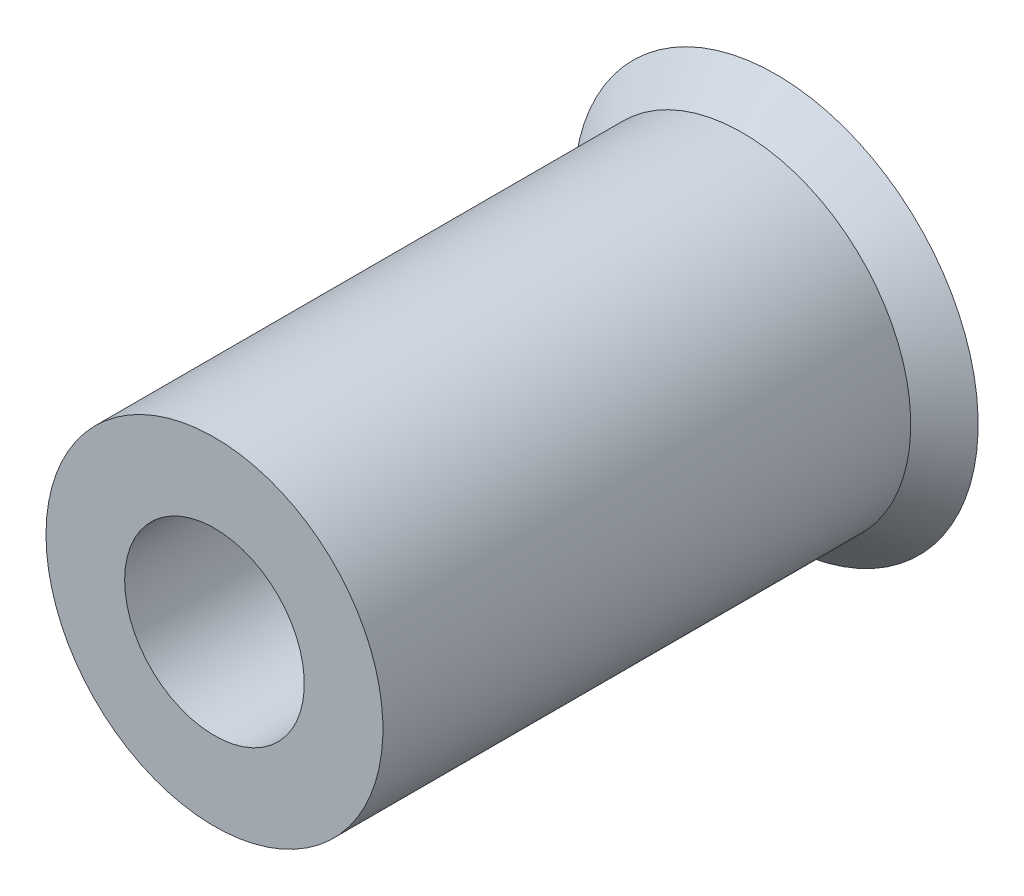
from build123d import *


with BuildPart() as part:
    # 草图1 → 旋转1 (revolve)
    with BuildSketch(Plane(origin=(0, 0, 0), x_dir=(0, 0, -1), z_dir=(1, 0, 0)), mode=Mode.PRIVATE) as revolve_1_sk:
        Polygon((-10, 1.6), (0, 1.6), (0, 3.6), (-0.6, 3), (-10, 3), align=None)
    revolve(revolve_1_sk.sketch.rotate(Axis((0, 0, 0), (0, 0, 1)), 90), axis=Axis((0, 0, 0), (0, 0, 1)))


solid = part.part
